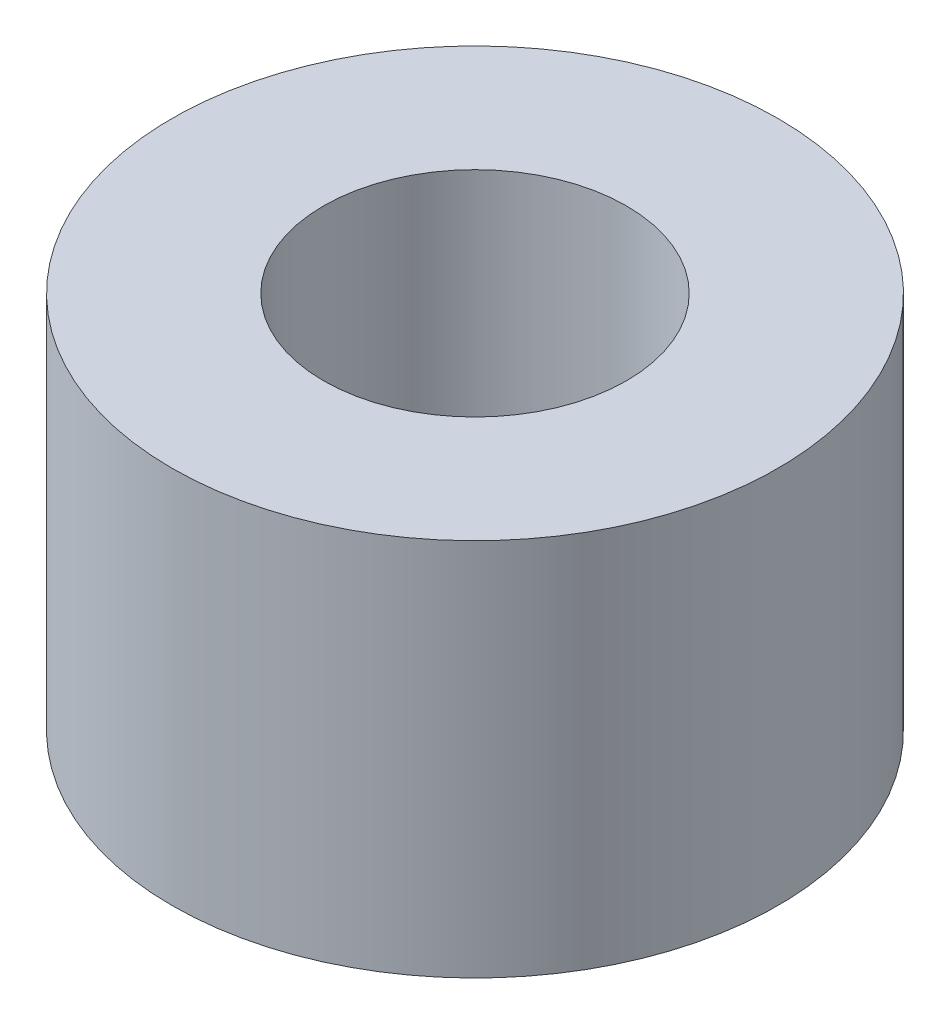
from build123d import *

# Parameters (mm, degrees)
SKETCH_1_R      = 2
SKETCH_1_R_2    = 1
EXTRUDE_1_DEPTH = 2.5


with BuildPart() as part:
    # 草图1 → 凸台-拉伸1 (new body)
    with BuildSketch(Plane(origin=(0, 0, 0), x_dir=(1, 0, 0), z_dir=(0, 1, 0))):
        with Locations(Location((0, 0, 0), (0, 0, 270))):
            Circle(SKETCH_1_R)
        with Locations(Location((0, 0, 0), (0, 0, 270))):
            Circle(SKETCH_1_R_2, mode=Mode.SUBTRACT)
    extrude(amount=EXTRUDE_1_DEPTH)


solid = part.part
